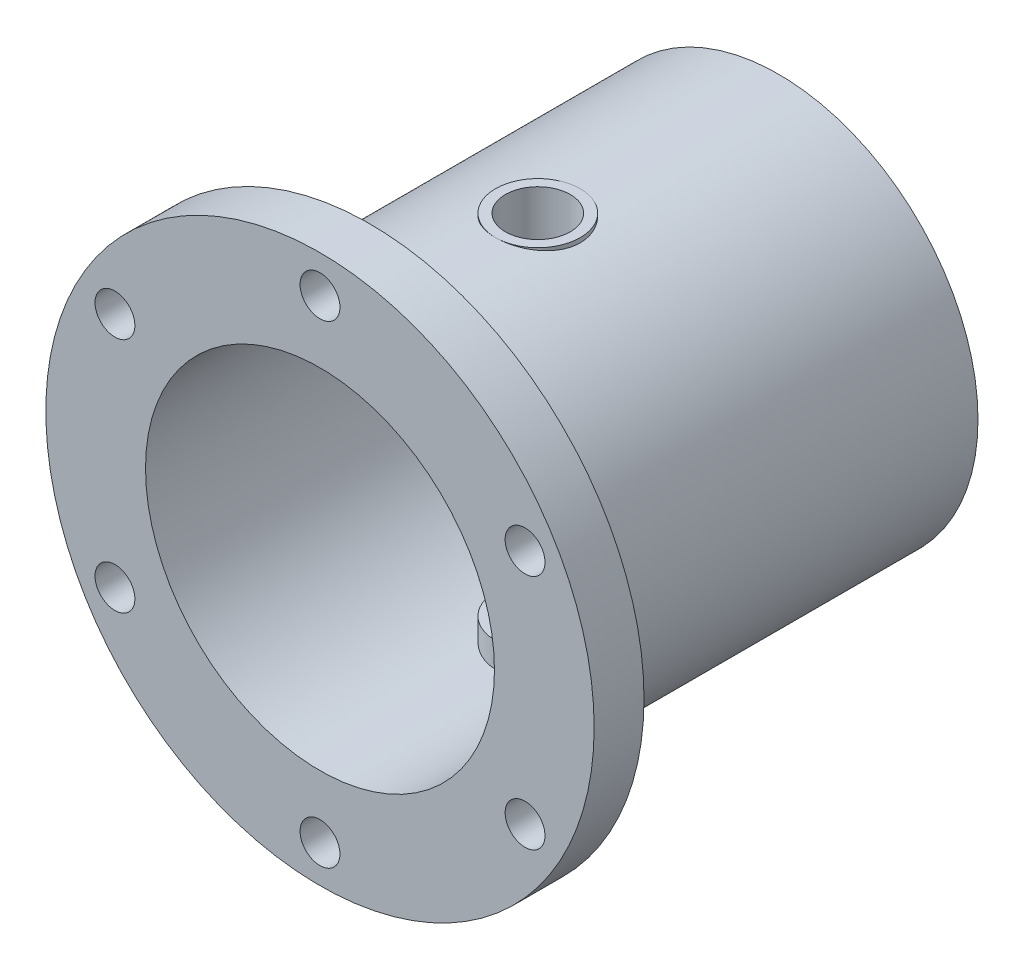
from build123d import *

# Parameters (mm, degrees)
SKETCH1_R               = 40
SKETCH1_R_2             = 35
BOSS_EXTRUDE1_DEPTH     = 92
SKETCH2_R               = 40
SKETCH2_R_2             = 13
BOSS_EXTRUDE2_DEPTH     = 6
CUT_EXTRUDE1_DEPTH      = 109
CUT_EXTRUDE1_DEPTH_BACK = 109
SKETCH3_R               = 6.5
SKETCH4_R               = 8.5
SKETCH4_R_2             = 6.5
BOSS_EXTRUDE3_DEPTH     = 10
BOSS_EXTRUDE4_START     = -10
SKETCH5_R               = 8.5
SKETCH5_R_2             = 6.5
BOSS_EXTRUDE4_DEPTH     = 10
BOSS_EXTRUDE5_START     = -10
SKETCH7_R               = 55
SKETCH7_R_2             = 35
BOSS_EXTRUDE5_DEPTH     = 10
CUT_EXTRUDE2_REACH      = 122.474
SKETCH8_R               = 4


with BuildPart() as part:
    # Sketch1 → Boss-Extrude1 (new body)
    with BuildSketch(Plane.XY):
        Circle(SKETCH1_R)
        Circle(SKETCH1_R_2, mode=Mode.SUBTRACT)
    extrude(amount=BOSS_EXTRUDE1_DEPTH)

    # Sketch2 → Boss-Extrude2 (add)
    with BuildSketch(Plane(origin=(0, 0, 0), x_dir=(-1, 0, 0), z_dir=(0, 0, -1))):
        with Locations(Location((0, 0, 0), (0, 0, 180))):
            Circle(SKETCH2_R)
        Circle(SKETCH2_R_2, mode=Mode.SUBTRACT)
    extrude(amount=-BOSS_EXTRUDE2_DEPTH)

    # Sketch3 → Cut-Extrude1 (cut, two sides: drawn at the far end of the back side and taken through both)
    with BuildSketch(Plane(origin=(0, 0, 0), x_dir=(1, 0, 0), z_dir=(0, 1, 0)).offset(-CUT_EXTRUDE1_DEPTH_BACK)):
        with Locations(Location((0, -48.29785344, 0), (0, 0, 270))):
            Circle(SKETCH3_R)
    extrude(amount=CUT_EXTRUDE1_DEPTH + CUT_EXTRUDE1_DEPTH_BACK, mode=Mode.SUBTRACT)

    # Sketch4 → Boss-Extrude3 (add)
    with BuildSketch(Plane(origin=(0, -40, 0), x_dir=(-1, 0, 0), z_dir=(0, -1, 0))):
        with Locations(Location((0, -48.29785344, 0), (0, 0, 90))):
            Circle(SKETCH4_R)
        with Locations(Location((0, -48.29785344, 0), (0, 0, 270))):
            Circle(SKETCH4_R_2, mode=Mode.SUBTRACT)
    extrude(amount=-BOSS_EXTRUDE3_DEPTH)

    # Sketch5 → Boss-Extrude4 (add)
    with BuildSketch(Plane(origin=(0, 40, 0), x_dir=(1, 0, 0), z_dir=(0, 1, 0)).offset(BOSS_EXTRUDE4_START)):
        with Locations(Location((0, -48.29785344, 0), (0, 0, 90))):
            Circle(SKETCH5_R)
        with Locations(Location((0, -48.29785344, 0), (0, 0, 90))):
            Circle(SKETCH5_R_2, mode=Mode.SUBTRACT)
    extrude(amount=BOSS_EXTRUDE4_DEPTH)

    # Sketch7 → Boss-Extrude5 (add)
    with BuildSketch(Plane.XY.offset(92).offset(BOSS_EXTRUDE5_START)):
        Circle(SKETCH7_R)
        with Locations(Location((0, 0, 0), (0, 0, 180))):
            Circle(SKETCH7_R_2, mode=Mode.SUBTRACT)
    extrude(amount=BOSS_EXTRUDE5_DEPTH)

    # Sketch8 → Cut-Extrude2 (cut, up to next)
    with BuildSketch(Plane.XY.offset(92), mode=Mode.PRIVATE) as cut_extrude2_sk1:
        with Locations((0, 47.5)):
            Circle(SKETCH8_R)
    cut_extrude2_tool1 = extrude(cut_extrude2_sk1.sketch, amount=-CUT_EXTRUDE2_REACH, mode=Mode.PRIVATE) & part.part
    # Sketch8 → Cut-Extrude2 (cut, up to next)
    with BuildSketch(Plane.XY.offset(92), mode=Mode.PRIVATE) as cut_extrude2_sk2:
        with Locations((41.13620668, 23.75)):
            Circle(SKETCH8_R)
    cut_extrude2_tool2 = extrude(cut_extrude2_sk2.sketch, amount=-CUT_EXTRUDE2_REACH, mode=Mode.PRIVATE) & part.part
    # Sketch8 → Cut-Extrude2 (cut, up to next)
    with BuildSketch(Plane.XY.offset(92), mode=Mode.PRIVATE) as cut_extrude2_sk3:
        with Locations((41.13620668, -23.75)):
            Circle(SKETCH8_R)
    cut_extrude2_tool3 = extrude(cut_extrude2_sk3.sketch, amount=-CUT_EXTRUDE2_REACH, mode=Mode.PRIVATE) & part.part
    # Sketch8 → Cut-Extrude2 (cut, up to next)
    with BuildSketch(Plane.XY.offset(92), mode=Mode.PRIVATE) as cut_extrude2_sk4:
        with Locations((0, -47.5)):
            Circle(SKETCH8_R)
    cut_extrude2_tool4 = extrude(cut_extrude2_sk4.sketch, amount=-CUT_EXTRUDE2_REACH, mode=Mode.PRIVATE) & part.part
    # Sketch8 → Cut-Extrude2 (cut, up to next)
    with BuildSketch(Plane.XY.offset(92), mode=Mode.PRIVATE) as cut_extrude2_sk5:
        with Locations((-41.13620668, -23.75)):
            Circle(SKETCH8_R)
    cut_extrude2_tool5 = extrude(cut_extrude2_sk5.sketch, amount=-CUT_EXTRUDE2_REACH, mode=Mode.PRIVATE) & part.part
    # Sketch8 → Cut-Extrude2 (cut, up to next)
    with BuildSketch(Plane.XY.offset(92), mode=Mode.PRIVATE) as cut_extrude2_sk6:
        with Locations((-41.13620668, 23.75)):
            Circle(SKETCH8_R)
    cut_extrude2_tool6 = extrude(cut_extrude2_sk6.sketch, amount=-CUT_EXTRUDE2_REACH, mode=Mode.PRIVATE) & part.part
    add(cut_extrude2_tool1.solids().sort_by_distance((0, 47.5, 92))[0], mode=Mode.SUBTRACT)
    add(cut_extrude2_tool2.solids().sort_by_distance((41.136207, 23.75, 92))[0], mode=Mode.SUBTRACT)
    add(cut_extrude2_tool3.solids().sort_by_distance((41.136207, -23.75, 92))[0], mode=Mode.SUBTRACT)
    add(cut_extrude2_tool4.solids().sort_by_distance((0, -47.5, 92))[0], mode=Mode.SUBTRACT)
    add(cut_extrude2_tool5.solids().sort_by_distance((-41.136207, -23.75, 92))[0], mode=Mode.SUBTRACT)
    add(cut_extrude2_tool6.solids().sort_by_distance((-41.136207, 23.75, 92))[0], mode=Mode.SUBTRACT)


solid = part.part
